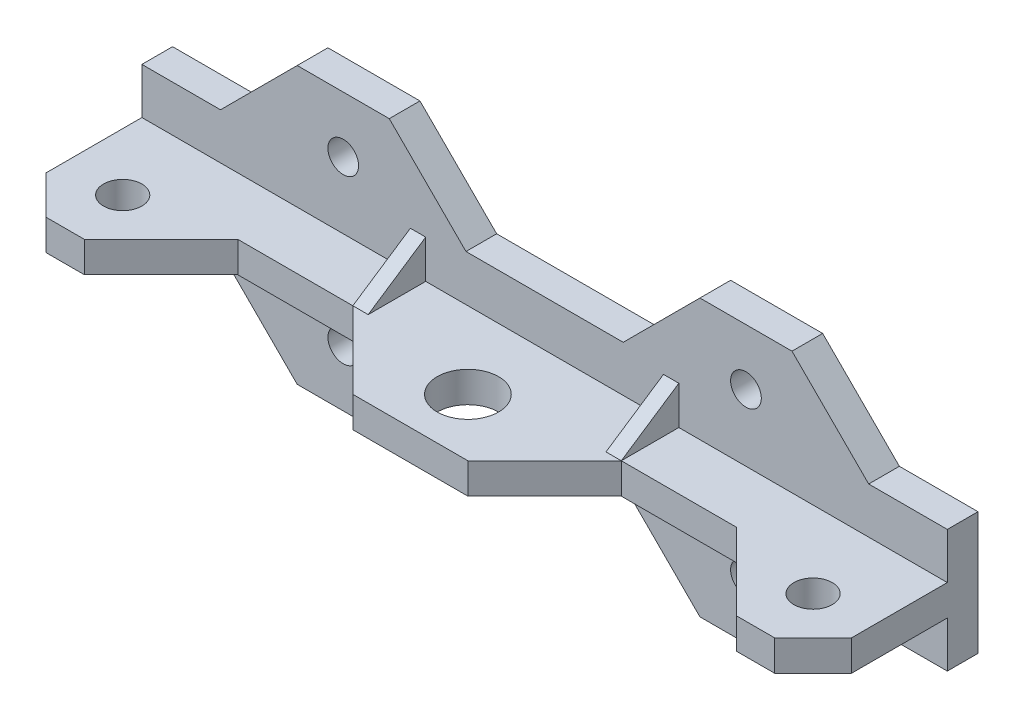
from build123d import *

# Parameters (mm, degrees)
BOSS_EXTRUDE1_DEPTH      = 2
BOSS_EXTRUDE1_DEPTH_BACK = 2
SKETCH2_R                = 4
SKETCH2_R_2              = 2.5
SKETCH4_R                = 2
BOSS_EXTRUDE2_DEPTH      = 4
BOSS_EXTRUDE3_DEPTH      = 2


with BuildPart() as part:
    # Sketch2 → Boss-Extrude1 (new, two sides: drawn at the far end of the back side and taken through both)
    with BuildSketch(Plane(origin=(0, 0, 0), x_dir=(1, 0, 0), z_dir=(0, 1, 0)).offset(-BOSS_EXTRUDE1_DEPTH_BACK)):
        Polygon((-52.5, 10), (52.5, 10), (52.5, 0), (52.5, -2.5), (47.5, -7.5), (42.5, -7.5), (32.5, 2.5), (17.5, 2.5), (7.5, -7.5), (-7.5, -7.5), (-17.5, 2.5), (-32.5, 2.5), (-42.5, -7.5), (-47.5, -7.5), (-52.5, -2.5), (-52.5, 0), align=None)
        Circle(SKETCH2_R, mode=Mode.SUBTRACT)
        with Locations((-45, 0)):
            Circle(SKETCH2_R_2, mode=Mode.SUBTRACT)
        with Locations((45, 0)):
            Circle(SKETCH2_R_2, mode=Mode.SUBTRACT)
    extrude(amount=BOSS_EXTRUDE1_DEPTH + BOSS_EXTRUDE1_DEPTH_BACK)

    # Sketch4 → Boss-Extrude2 (add)
    with BuildSketch(Plane(origin=(0, 0, -10), x_dir=(-1, 0, 0), z_dir=(0, 0, -1))):
        Polygon((52.5, -8), (42.25, -8), (32.25, -18), (20.25, -18), (10.25, -8), (-10.25, -8), (-20.25, -18), (-32.25, -18), (-42.25, -8), (-52.5, -8), (-52.5, 8), (-42.25, 8), (-32.25, 18), (-20.25, 18), (-10.25, 8), (10.25, 8), (20.25, 18), (32.25, 18), (42.25, 8), (52.5, 8), align=None)
        with Locations((26.25, -10.674724776)):
            Circle(SKETCH4_R, mode=Mode.SUBTRACT)
        with Locations((-26.25, -10.674724776)):
            Circle(SKETCH4_R, mode=Mode.SUBTRACT)
        with Locations((-26.25, 10.674724776)):
            Circle(SKETCH4_R, mode=Mode.SUBTRACT)
        with Locations((26.25, 10.674724776)):
            Circle(SKETCH4_R, mode=Mode.SUBTRACT)
    extrude(amount=BOSS_EXTRUDE2_DEPTH)

    # Sketch5 → Boss-Extrude3 (add)
    with BuildSketch(Plane.ZY.offset(17.5)):
        Polygon((-10, 7), (-10, 2), (-2.5, 2), align=None)
        Polygon((-2.5, -2), (-10, -7), (-10, -2), align=None)
    boss_extrude3 = extrude(amount=-BOSS_EXTRUDE3_DEPTH)

    # Mirror1: Boss-Extrude3 across plane
    add(boss_extrude3.mirror(Plane(origin=(0, 0, 0), x_dir=(0, 0, 1), z_dir=(1, 0, 0))))


solid = part.part
